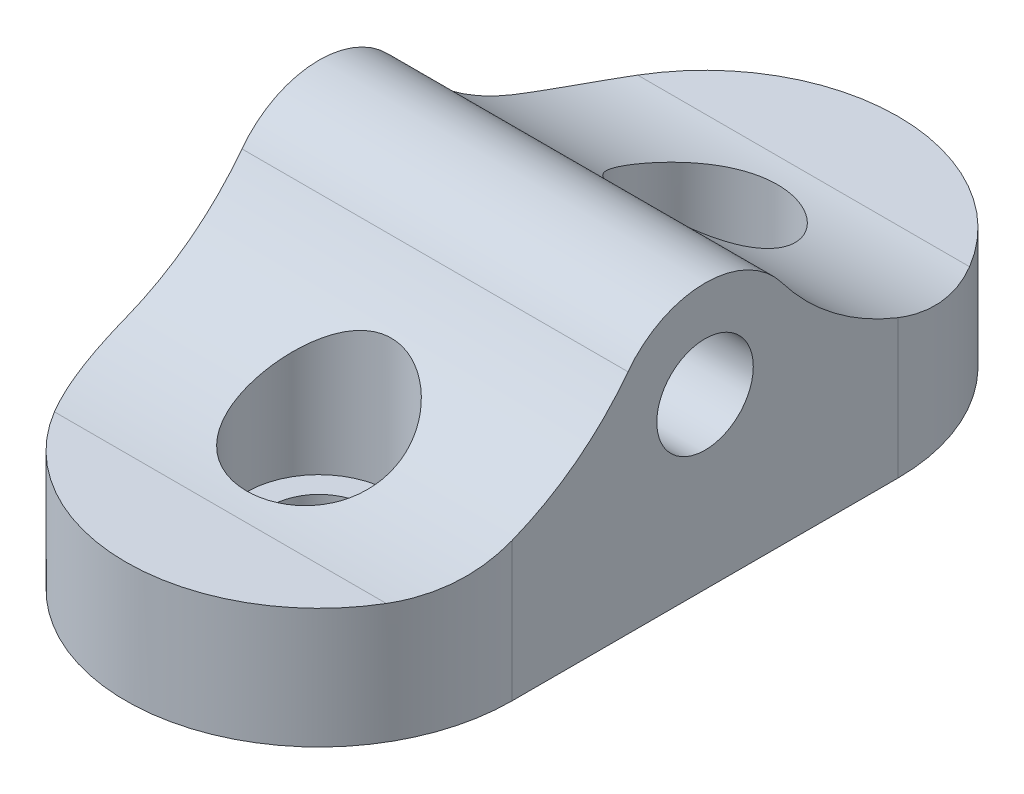
from build123d import *

# Parameters (mm, degrees)
SKETCH2_R               = 3.175
BOSS_EXTRUDE1_DEPTH     = 25.4
CUT_EXTRUDE1_DEPTH      = 39.1
CUT_EXTRUDE1_DEPTH_BACK = 39.1
SKETCH3_R               = 3.175
SKETCH4_R               = 4.7625
CUT_EXTRUDE2_DEPTH      = 22.225


with BuildPart() as part:
    # Sketch2 → Boss-Extrude1 (new body)
    with BuildSketch(Plane(origin=(0, 0, 0), x_dir=(1, 0, 0), z_dir=(0, 1, 0))):
        with BuildLine():
            Line((12.7, 12.7), (12.7, -12.7))
            ThreePointArc((12.7, -12.7), (0, -25.4), (-12.7, -12.7))
            Line((-12.7, -12.7), (-12.7, 12.7))
            ThreePointArc((-12.7, 12.7), (0, 25.4), (12.7, 12.7))
        make_face()
        with Locations(Location((0, 12.7, 0), (0, 0, 270))):
            Circle(SKETCH2_R, mode=Mode.SUBTRACT)
        with Locations(Location((0, -12.7, 0), (0, 0, 270))):
            Circle(SKETCH2_R, mode=Mode.SUBTRACT)
    extrude(amount=BOSS_EXTRUDE1_DEPTH)

    # Sketch3 → Cut-Extrude1 (cut, two sides: drawn at the far end of the back side and taken through both)
    with BuildSketch(Plane(origin=(0, 0, 0), x_dir=(0, 0, -1), z_dir=(1, 0, 0)).offset(-CUT_EXTRUDE1_DEPTH_BACK)):
        with Locations((0, 11.1125)):
            Circle(SKETCH3_R)
        with BuildLine():
            Line((-25.4, 7.90575), (-19.186582283, 7.90575))
            ThreePointArc((-19.186582283, 7.90575), (-11.300258027, 9.761112271), (-5.068357629, 14.937973951))
            ThreePointArc((-5.068357629, 14.937973951), (0, 17.4625), (5.068357629, 14.937973951))
            ThreePointArc((5.068357629, 14.937973951), (11.300258027, 9.761112271), (19.186582283, 7.90575))
            Line((19.186582283, 7.90575), (25.4, 7.90575))
            Line((25.4, 7.90575), (25.4, 30.015599029))
            Line((25.4, 30.015599029), (-31.207208801, 35.201112742))
            Line((-31.207208801, 35.201112742), (-25.4, 7.90575))
        make_face()
    extrude(amount=CUT_EXTRUDE1_DEPTH + CUT_EXTRUDE1_DEPTH_BACK, mode=Mode.SUBTRACT)

    # Sketch4 → Cut-Extrude2 (cut)
    with BuildSketch(Plane(origin=(0, 25.4, 0), x_dir=(1, 0, 0), z_dir=(0, 1, 0))):
        with Locations(Location((0, -12.7, 0), (0, 0, 270))):
            Circle(SKETCH4_R)
        with Locations(Location((0, 12.7, 0), (0, 0, 270))):
            Circle(SKETCH4_R)
    extrude(amount=-CUT_EXTRUDE2_DEPTH, mode=Mode.SUBTRACT)


solid = part.part
